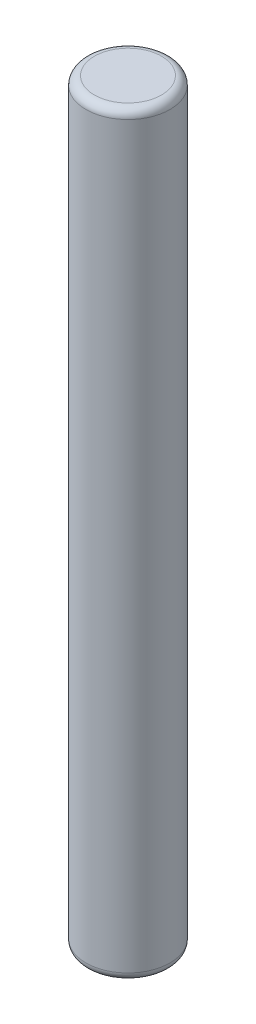
from build123d import *

# Parameters (mm, degrees)
SKETCH2_R           = 1
BOSS_EXTRUDE1_DEPTH = 18
FILLET1_R           = 0.2


with BuildPart() as part:
    # Sketch2 → Boss-Extrude1 (new body)
    with BuildSketch(Plane(origin=(0, 0, 0), x_dir=(1, 0, 0), z_dir=(0, 1, 0))):
        with Locations(Location((0, 0, 0), (0, 0, 270))):
            Circle(SKETCH2_R)
    extrude(amount=BOSS_EXTRUDE1_DEPTH)

    # Fillet1
    fillet1_edges = [part.edges().sort_by_distance(p)[0] for p in [
        (0, 0, -1),
        (0, 18, -1),
    ]]
    fillet(fillet1_edges, radius=FILLET1_R)


solid = part.part
